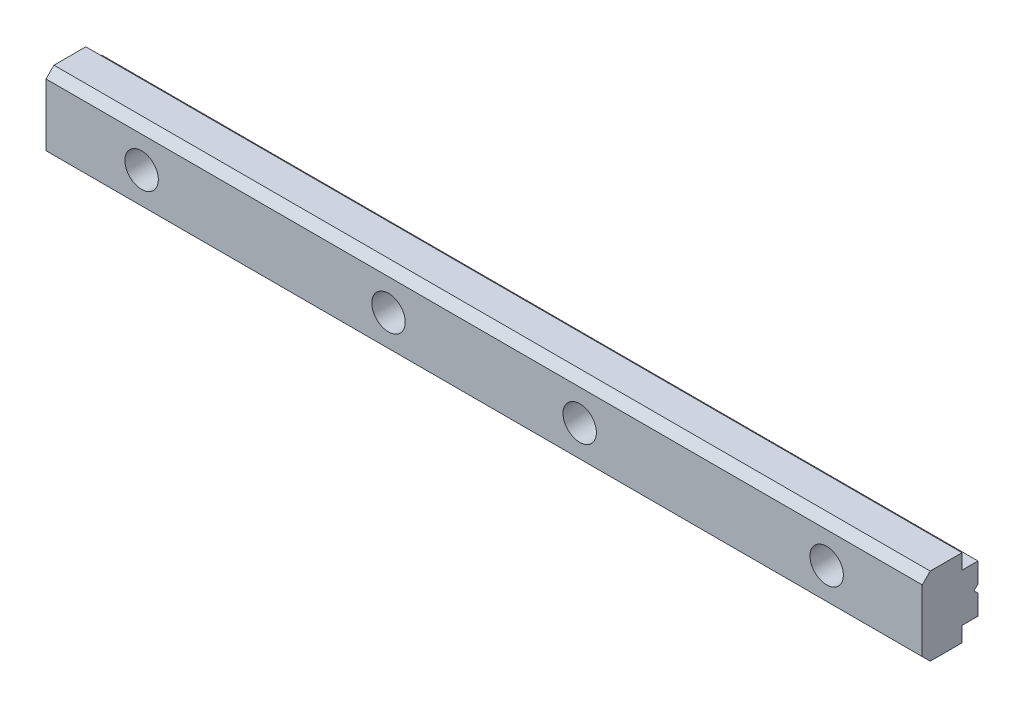
from build123d import *

# Parameters (mm, degrees)
EXTRUDE_1_DEPTH        = 55
HOLE_WIZARD_M5_1_D     = 4.2
HOLE_WIZARD_M5_1_DEPTH = 52.4
HOLE_WIZARD_M5_1_TIP   = 1.2618073


with BuildPart() as part:
    # 草图1 → 凸台-拉伸1 (new, symmetric)
    with BuildSketch(Plane(origin=(0, 0, 0), x_dir=(0, 0, -1), z_dir=(1, 0, 0))):
        Polygon((-7, -0.9), (-7, 6.9), (-6, 7.9), (-2, 7.9), (-2, 6), (0, 6), (0, 3.5), (-0.5, 3), (0, 2.5), (0, 0), (-2, 0), (-2, -1.9), (-6, -1.9), align=None)
    extrude(amount=EXTRUDE_1_DEPTH, both=True)

    # M5 螺纹孔1
    with Locations(Plane(origin=(43, 3, 0), x_dir=(-1, 0, 0), z_dir=(0, 0, -1))):
        with Locations((0, 0), (31, 0), (55, 0), (86, 0)):
            Hole(HOLE_WIZARD_M5_1_D / 2, depth=HOLE_WIZARD_M5_1_DEPTH)
            with Locations((0, 0, -(HOLE_WIZARD_M5_1_DEPTH + HOLE_WIZARD_M5_1_TIP / 2))):  # 118° drill point
                Cone(0, HOLE_WIZARD_M5_1_D / 2, HOLE_WIZARD_M5_1_TIP, mode=Mode.SUBTRACT)


solid = part.part
